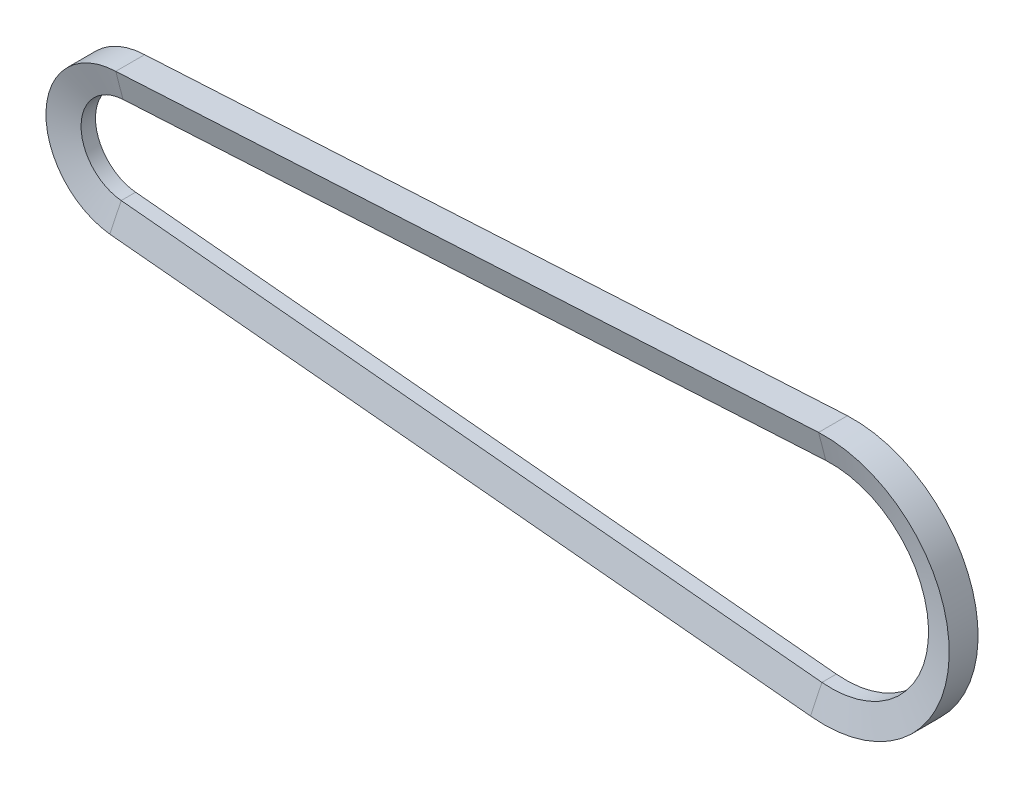
from build123d import *


with BuildPart() as part:
    # Sweep1: sweep along a path in Sketch2
    with BuildLine(Plane.XY) as sweep1_path:
        Line((-1.284227852, -13.438778175), (-98.433987772, -4.155015479))
        ThreePointArc((-98.433987772, -4.155015479), (-103.998761627, 2.091962576), (-98.18727165, 8.110104079))
        Line((-98.18727165, 8.110104079), (-0.742758535, 13.479551541))
        ThreePointArc((-0.742758535, 13.479551541), (13.497269618, -0.271501146), (-1.284227852, -13.438778175))
    # Sketch3 → Sweep1 (sweep)
    with BuildSketch(Plane(origin=(-0.742758535, 0, 0), x_dir=(0, 0, -1), z_dir=(1, 0, 0))):
        Polygon((-2, 17.352534888), (2, 17.352534888), (1, 13.479551541), (-1, 13.479551541), align=None)
    sweep(path=sweep1_path.line)


solid = part.part
